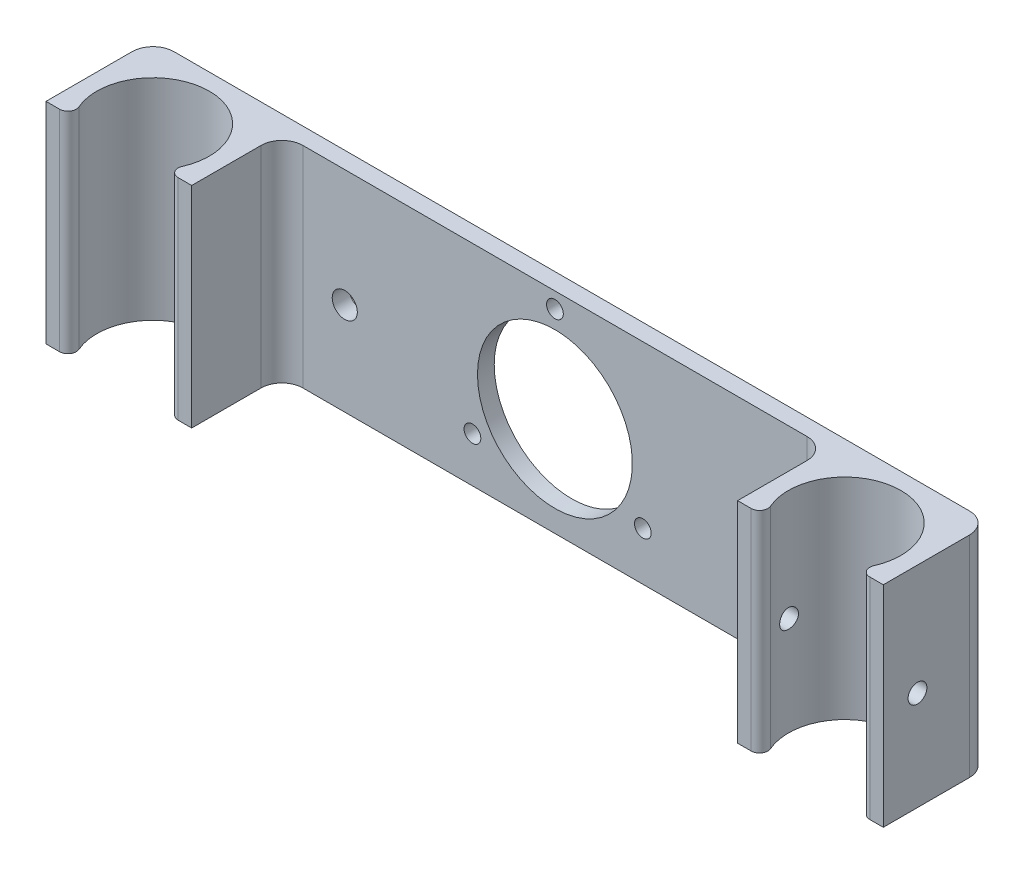
from build123d import *

# Parameters (mm, degrees)
BOSS_EXTRUDE2_START = -1
SKETCH1_R           = 13.45
BOSS_EXTRUDE2_DEPTH = 53
FILLET1_R           = 3
FILLET2_R           = 5
SKETCH9_R           = 2.25
CUT_EXTRUDE2_DEPTH  = 175.062632406
CUT_EXTRUDE4_DEPTH  = 61
FILLET3_R           = 2
SKETCH12_R          = 18.5
SKETCH12_R_2        = 2
CUT_EXTRUDE5_DEPTH  = 61
SKETCH13_R          = 3
CUT_EXTRUDE8_DEPTH  = 41
SKETCH14_W          = 211.811280225
SKETCH14_H          = 13.838629025
CUT_EXTRUDE10_DEPTH = 41


with BuildPart() as part:
    # Sketch1 → Boss-Extrude2 (new body)
    with BuildSketch(Plane(origin=(0, 0, 0), x_dir=(1, 0, 0), z_dir=(0, 1, 0)).offset(BOSS_EXTRUDE2_START)):
        Polygon((-17.4, 17.4), (17.4, 17.4), (17.4, -17.4), (-17.4, -17.4), (-17.4, 13.4), (-82.6, 13.4), (-82.6, 17.4), align=None)
        with Locations(Location((0, 0, 0), (0, 0, 270))):
            Circle(SKETCH1_R, mode=Mode.SUBTRACT)
    boss_extrude2 = extrude(amount=BOSS_EXTRUDE2_DEPTH)

    # Mirror2: Boss-Extrude2 across plane
    add(boss_extrude2.mirror(Plane(origin=(-82.6, -1, -17.4), x_dir=(0, 0, 1), z_dir=(-1, 0, 0))))

    # Fillet1
    fillet1_edges = [part.edges().sort_by_distance(p)[0] for p in [
        (17.4, 25.5, 17.4),
        (-17.4, 25.5, 17.4),
        (-182.6, 25.5, 17.4),
        (-147.8, 25.5, 17.4),
    ]]
    fillet(fillet1_edges, radius=FILLET1_R)

    # Fillet2
    fillet2_edges = [part.edges().sort_by_distance(p)[0] for p in [
        (-17.4, 25.5, -13.4),
        (17.4, 25.5, -17.4),
        (-182.6, 25.5, -17.4),
        (-147.8, 25.5, -13.4),
    ]]
    fillet(fillet2_edges, radius=FILLET2_R)

    # Sketch9 → Cut-Extrude2 (cut, through all)
    with BuildSketch(Plane.ZY.offset(17.4)):
        with Locations((0, 25.5)):
            Circle(SKETCH9_R)
    extrude(amount=-CUT_EXTRUDE2_DEPTH, mode=Mode.SUBTRACT)

    # Sketch11 → Cut-Extrude4 (cut)
    with BuildSketch(Plane.XZ.offset(1)):
        Polygon((17.4, 11.356288415), (17.4, 18.363602968), (-17.4, 18.363602968), (-17.4, 11.356288415), (-17.4, 8.165104504), (-10.6880105, 8.165104504), (10.6880105, 8.165104504), (17.4, 8.165104504), align=None)
        Polygon((-182.6, 11.356288415), (-182.6, 18.363602968), (-147.8, 18.363602968), (-147.8, 11.356288415), (-147.8, 8.165104504), (-154.5119895, 8.165104504), (-175.8880105, 8.165104504), (-182.6, 8.165104504), align=None)
    extrude(amount=-CUT_EXTRUDE4_DEPTH, mode=Mode.SUBTRACT)

    # Fillet3
    fillet3_edges = [part.edges().sort_by_distance(p)[0] for p in [
        (-154.5119895, 25.5, 8.165104504),
        (-175.8880105, 25.5, 8.165104504),
        (10.6880105, 25.5, 8.165104504),
        (-10.6880105, 25.5, 8.165104504),
    ]]
    fillet(fillet3_edges, radius=FILLET3_R)

    # Sketch12 → Cut-Extrude5 (cut)
    with BuildSketch(Plane(origin=(0, 0, -17.4), x_dir=(-1, 0, 0), z_dir=(0, 0, -1))):
        with Locations((82.6, 25.5)):
            Circle(SKETCH12_R)
        with Locations((82.6, 48.25)):
            Circle(SKETCH12_R_2)
        with Locations((102.302077936, 12.625)):
            Circle(SKETCH12_R_2)
        with Locations((61.598883958, 13.375)):
            Circle(SKETCH12_R_2)
    extrude(amount=-CUT_EXTRUDE5_DEPTH, mode=Mode.SUBTRACT)

    # Sketch13 → Cut-Extrude8 (cut)
    with BuildSketch(Plane(origin=(0, 0, -17.4), x_dir=(-1, 0, 0), z_dir=(0, 0, -1))):
        with Locations((132.8, 24)):
            Circle(SKETCH13_R)
        with Locations((32.4, 24)):
            Circle(SKETCH13_R)
    extrude(amount=-CUT_EXTRUDE8_DEPTH, mode=Mode.SUBTRACT)

    # Sketch14 → Cut-Extrude10 (cut)
    with BuildSketch(Plane(origin=(0, 0, -17.4), x_dir=(-1, 0, 0), z_dir=(0, 0, -1))):
        with Locations((80.800037621, -5.103044057)):
            Rectangle(SKETCH14_W, SKETCH14_H)
    extrude(amount=-CUT_EXTRUDE10_DEPTH, mode=Mode.SUBTRACT)


solid = part.part
